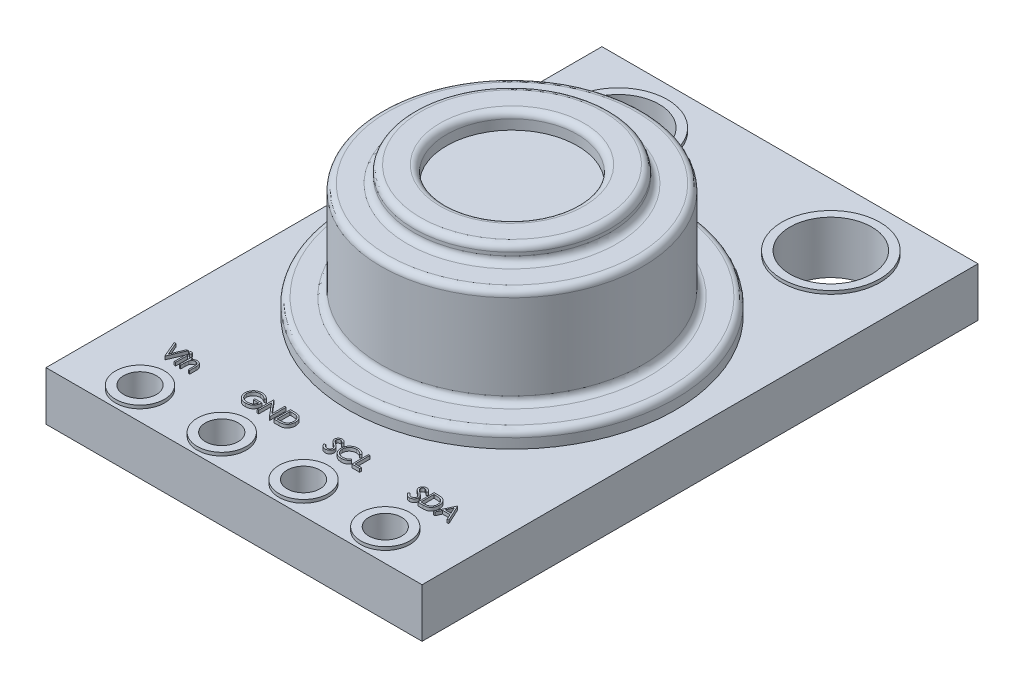
from build123d import *

# Parameters (mm, degrees)
ESBO_O1_W                = 11.5
ESBO_O1_H                = 17
RESSALTO_EXTRUS_O1_DEPTH = 1.5
ESBO_O4_R                = 5
RESSALTO_EXTRUS_O2_DEPTH = 0.5
ESBO_O5_R                = 4
RESSALTO_EXTRUS_O3_DEPTH = 3
ESBO_O6_R                = 3
RESSALTO_EXTRUS_O4_DEPTH = 0.5
ESBO_O7_R                = 2
CORTE_EXTRUS_O1_DEPTH    = 0.5
FILETE1_R                = 0.2
ESBO_O8_R                = 1.5
ESBO_O8_R_2              = 1.25
ESBO_O8_R_3              = 0.75
ESBO_O8_R_4              = 0.5
RESSALTO_EXTRUS_O5_DEPTH = 0.1
CORTE_EXTRUS_O4_START    = -3
ESBO_O9_R                = 0.5
ESBO_O9_R_2              = 1.25
CORTE_EXTRUS_O4_DEPTH    = 3
ESBO_O10_W               = 0.044871795
ESBO_O10_H               = 0.365384616
RESSALTO_EXTRUS_O6_DEPTH = 0.1


with BuildPart() as part:
    # Esboço1 → Ressalto-extrusão1 (new body)
    with BuildSketch(Plane(origin=(0, 0, 0), x_dir=(1, 0, 0), z_dir=(0, 1, 0))):
        with Locations((5.75, 8.5)):
            Rectangle(ESBO_O1_W, ESBO_O1_H)
    extrude(amount=RESSALTO_EXTRUS_O1_DEPTH)

    # Esboço4 → Ressalto-extrusão2 (add)
    with BuildSketch(Plane(origin=(0, 1.5, 0), x_dir=(1, 0, 0), z_dir=(0, 1, 0))):
        with Locations(Location((5.75, 8.5, 0), (0, 0, 270))):
            Circle(ESBO_O4_R)
    extrude(amount=RESSALTO_EXTRUS_O2_DEPTH)

    # Esboço5 → Ressalto-extrusão3 (add)
    with BuildSketch(Plane(origin=(0, 2, 0), x_dir=(1, 0, 0), z_dir=(0, 1, 0))):
        with Locations(Location((5.75, 8.5, 0), (0, 0, 270))):
            Circle(ESBO_O5_R)
    extrude(amount=RESSALTO_EXTRUS_O3_DEPTH)

    # Esboço6 → Ressalto-extrusão4 (add)
    with BuildSketch(Plane(origin=(0, 5, 0), x_dir=(1, 0, 0), z_dir=(0, 1, 0))):
        with Locations(Location((5.75, 8.5, 0), (0, 0, 270))):
            Circle(ESBO_O6_R)
    extrude(amount=RESSALTO_EXTRUS_O4_DEPTH)

    # Esboço7 → Corte-extrusão1 (cut)
    with BuildSketch(Plane(origin=(0, 5.5, 0), x_dir=(1, 0, 0), z_dir=(0, 1, 0))):
        with Locations(Location((5.75, 8.5, 0), (0, 0, 270))):
            Circle(ESBO_O7_R)
    extrude(amount=-CORTE_EXTRUS_O1_DEPTH, mode=Mode.SUBTRACT)

    # Filete1
    filete1_edges = [part.edges().sort_by_distance(p)[0] for p in [
        (5.75, 2, -13.5),
        (5.75, 2, -12.5),
        (5.75, 5, -12.5),
        (5.75, 5, -11.5),
        (5.75, 5.5, -11.5),
        (5.75, 5.5, -10.5),
    ]]
    fillet(filete1_edges, radius=FILETE1_R)

    # Esboço8 → Ressalto-extrusão5 (add)
    # profile 1 of 6: a face of its own
    with BuildSketch(Plane(origin=(0, 1.5, 0), x_dir=(1, 0, 0), z_dir=(0, 1, 0))):
        with Locations(Location((2.5, 15, 0), (0, 0, 90))):
            Circle(ESBO_O8_R)
        with Locations(Location((2.5, 15, 0), (0, 0, 270))):
            Circle(ESBO_O8_R_2, mode=Mode.SUBTRACT)
    # profile 2 of 6: a face of its own
    with BuildSketch(Plane(origin=(0, 1.5, 0), x_dir=(1, 0, 0), z_dir=(0, 1, 0))):
        with Locations(Location((9, 15, 0), (0, 0, 90))):
            Circle(ESBO_O8_R)
        with Locations(Location((9, 15, 0), (0, 0, 270))):
            Circle(ESBO_O8_R_2, mode=Mode.SUBTRACT)
    # profile 3 of 6: a face of its own
    with BuildSketch(Plane(origin=(0, 1.5, 0), x_dir=(1, 0, 0), z_dir=(0, 1, 0))):
        with Locations(Location((4.5, 0.875, 0), (0, 0, 90))):
            Circle(ESBO_O8_R_3)
        with Locations(Location((4.5, 0.875, 0), (0, 0, 270))):
            Circle(ESBO_O8_R_4, mode=Mode.SUBTRACT)
    # profile 4 of 6: a face of its own
    with BuildSketch(Plane(origin=(0, 1.5, 0), x_dir=(1, 0, 0), z_dir=(0, 1, 0))):
        with Locations(Location((2, 0.875, 0), (0, 0, 90))):
            Circle(ESBO_O8_R_3)
        with Locations(Location((2, 0.875, 0), (0, 0, 270))):
            Circle(ESBO_O8_R_4, mode=Mode.SUBTRACT)
    # profile 5 of 6: a face of its own
    with BuildSketch(Plane(origin=(0, 1.5, 0), x_dir=(1, 0, 0), z_dir=(0, 1, 0))):
        with Locations(Location((9.5, 0.875, 0), (0, 0, 90))):
            Circle(ESBO_O8_R_3)
        with Locations(Location((9.5, 0.875, 0), (0, 0, 90))):
            Circle(ESBO_O8_R_4, mode=Mode.SUBTRACT)
    # profile 6 of 6: a face of its own
    with BuildSketch(Plane(origin=(0, 1.5, 0), x_dir=(1, 0, 0), z_dir=(0, 1, 0))):
        with Locations(Location((7, 0.875, 0), (0, 0, 90))):
            Circle(ESBO_O8_R_3)
        with Locations(Location((7, 0.875, 0), (0, 0, 90))):
            Circle(ESBO_O8_R_4, mode=Mode.SUBTRACT)
    extrude(amount=RESSALTO_EXTRUS_O5_DEPTH)

    # Esboço9 → Corte-extrusão4 (cut)
    with BuildSketch(Plane(origin=(0, 1.5, 0), x_dir=(1, 0, 0), z_dir=(0, 1, 0)).offset(CORTE_EXTRUS_O4_START)):
        with Locations(Location((9.5, 0.875, 0), (0, 0, 90))):
            Circle(ESBO_O9_R)
        with Locations(Location((7, 0.875, 0), (0, 0, 90))):
            Circle(ESBO_O9_R)
        with Locations(Location((4.5, 0.875, 0), (0, 0, 90))):
            Circle(ESBO_O9_R)
        with Locations(Location((2, 0.875, 0), (0, 0, 90))):
            Circle(ESBO_O9_R)
        with Locations(Location((9, 15, 0), (0, 0, 90))):
            Circle(ESBO_O9_R_2)
        with Locations(Location((2.5, 15, 0), (0, 0, 90))):
            Circle(ESBO_O9_R_2)
    extrude(amount=CORTE_EXTRUS_O4_DEPTH, mode=Mode.SUBTRACT)

    # Esboço10 → Ressalto-extrusão6 (add)
    # profile 1 of 13: a face of its own
    with BuildSketch(Plane(origin=(0, 1.5, 0), x_dir=(1, 0, 0), z_dir=(0, 1, 0))):
        Polygon((1.397435897, 2.523635238), (1.445512821, 2.523635238), (1.612179487, 2.12960479), (1.778846154, 2.523635238), (1.826923077, 2.523635238), (1.615384615, 2.023635238), (1.608974359, 2.023635238), align=None)
    # profile 2 of 13: a face of its own
    with BuildSketch(Plane(origin=(0, 1.5, 0), x_dir=(1, 0, 0), z_dir=(0, 1, 0))):
        with BuildLine():
            add(Edge.make_bspline(
                [(1.919671474, 2.542866008), (1.922455948, 2.542736843), (1.927908482, 2.542483914), (1.935793235, 2.540317989), (1.942972808, 2.536646605), (1.949341056, 2.531720936), (1.954805611, 2.525928159), (1.958631427, 2.519176592), (1.96109034, 2.5118825), (1.961387277, 2.506794631), (1.961538462, 2.504204149)],
                knots=[0, 0, 0, 0, 1.055194115, 2.066272739, 3.074728998, 4.095836921, 5.109056067, 6.073838105, 7.019297344, 8, 8, 8, 8], degree=3))
            add(Edge.make_bspline(
                [(1.961538462, 2.504204149), (1.961383867, 2.501680913), (1.961078253, 2.496692773), (1.958633326, 2.489525134), (1.954773006, 2.48286738), (1.94934456, 2.47708585), (1.942971879, 2.472162904), (1.935793481, 2.468490798), (1.927908417, 2.466325064), (1.922455926, 2.466072109), (1.919671474, 2.465942931)],
                knots=[0, 0, 0, 0, 0.96129708, 1.900370562, 2.859976407, 3.87933698, 4.906634145, 5.921202961, 6.938410037, 8, 8, 8, 8], degree=3))
            add(Edge.make_bspline(
                [(1.919671474, 2.465942931), (1.916918864, 2.466067176), (1.911561266, 2.466309005), (1.903794575, 2.468533293), (1.896676219, 2.47216416), (1.890295552, 2.477053615), (1.884976953, 2.482902886), (1.881105763, 2.489521071), (1.878666483, 2.496693808), (1.878360107, 2.50168126), (1.878205128, 2.504204149)],
                knots=[0, 0, 0, 0, 1.054934014, 2.053291228, 3.073705704, 4.106921865, 5.123545215, 6.088680038, 7.033164197, 8, 8, 8, 8], degree=3))
            add(Edge.make_bspline(
                [(1.878205128, 2.504204149), (1.878356712, 2.50679427), (1.878654432, 2.511881432), (1.881107592, 2.519180722), (1.884944707, 2.525892365), (1.890299073, 2.531753151), (1.896675282, 2.536645356), (1.903794817, 2.540275496), (1.911561202, 2.542499973), (1.916918842, 2.542741775), (1.919671474, 2.542866008)],
                knots=[0, 0, 0, 0, 0.98631895, 1.937192651, 2.907499808, 3.917963147, 4.944918757, 5.95915025, 6.951458133, 8, 8, 8, 8], degree=3))
        make_face()
    # profile 3 of 13: a face of its own
    with BuildSketch(Plane(origin=(0, 1.5, 0), x_dir=(1, 0, 0), z_dir=(0, 1, 0))):
        with Locations((1.919871795, 2.206327546)):
            Rectangle(ESBO_O10_W, ESBO_O10_H)
    # profile 4 of 13: a face of its own
    with BuildSketch(Plane(origin=(0, 1.5, 0), x_dir=(1, 0, 0), z_dir=(0, 1, 0))):
        with BuildLine():
            Line((2.051282051, 2.389019854), (2.096153846, 2.389019854))
            Line((2.096153846, 2.389019854), (2.096153846, 2.323114405))
            add(Edge.make_bspline(
                [(2.096153846, 2.323114405), (2.100944937, 2.329091937), (2.110242216, 2.340691546), (2.125725692, 2.355937342), (2.142089106, 2.368500946), (2.159232249, 2.378515774), (2.177178394, 2.386065292), (2.195818147, 2.391517568), (2.215263105, 2.394786829), (2.228486596, 2.395214005), (2.235176282, 2.39543011)],
                knots=[0, 0, 0, 0, 1.12780773, 2.188550248, 3.19190651, 4.159438251, 5.104880172, 6.052711206, 7.014878035, 8, 8, 8, 8], degree=3))
            add(Edge.make_bspline(
                [(2.235176282, 2.39543011), (2.241937801, 2.395180797), (2.255171725, 2.39469283), (2.27444002, 2.390833302), (2.292436219, 2.384241123), (2.309096155, 2.375210827), (2.324114329, 2.363981331), (2.337303593, 2.350898791), (2.348212628, 2.335850779), (2.355526537, 2.321890328), (2.360344487, 2.309506215), (2.363377678, 2.298899536), (2.365953533, 2.287082657), (2.36818664, 2.274091287), (2.369697656, 2.259834403), (2.370889411, 2.244370447), (2.371743511, 2.227704428), (2.371777397, 2.216177767), (2.371794872, 2.210233796)],
                knots=[0, 0, 0, 0, 1.235846778, 2.418850247, 3.575807741, 4.728682307, 5.871620074, 6.994088408, 8.11269785, 9.256955736, 9.865816715, 10.540099792, 11.271859618, 12.076849838, 12.949306005, 13.892391288, 14.913166135, 16, 16, 16, 16], degree=3))
            Line((2.371794872, 2.210233796), (2.371794872, 2.023635238))
            Line((2.371794872, 2.023635238), (2.326923077, 2.023635238))
            Line((2.326923077, 2.023635238), (2.326923077, 2.195510238))
            add(Edge.make_bspline(
                [(2.326923077, 2.195510238), (2.326895476, 2.200484873), (2.326842679, 2.210000504), (2.326676159, 2.22362465), (2.326274758, 2.235979875), (2.325710713, 2.247036642), (2.324885137, 2.256784333), (2.324024761, 2.265242801), (2.322972622, 2.272401307), (2.322035063, 2.276710605), (2.321614583, 2.278643251)],
                knots=[0, 0, 0, 0, 1.430800155, 2.736877192, 3.918605307, 4.986035426, 5.920637409, 6.731861385, 7.431261377, 8, 8, 8, 8], degree=3))
            add(Edge.make_bspline(
                [(2.321614583, 2.278643251), (2.32009665, 2.284316278), (2.317175099, 2.295235098), (2.309955958, 2.31004572), (2.300839647, 2.322645461), (2.289711383, 2.332956421), (2.276678657, 2.340980827), (2.261777637, 2.346548535), (2.245152117, 2.350030859), (2.233458634, 2.350377592), (2.227363782, 2.350558315)],
                knots=[0, 0, 0, 0, 1.084156227, 2.086665306, 3.027808233, 3.945421172, 4.874247719, 5.839848303, 6.874090471, 8, 8, 8, 8], degree=3))
            add(Edge.make_bspline(
                [(2.227363782, 2.350558315), (2.223754113, 2.350490315), (2.216610671, 2.350355743), (2.206017818, 2.349005558), (2.195742936, 2.346797207), (2.185682906, 2.343815973), (2.176038936, 2.339721363), (2.16650118, 2.33507431), (2.157428785, 2.329281708), (2.1486283, 2.322825905), (2.140440756, 2.315671733), (2.132822422, 2.308122517), (2.126031276, 2.300083145), (2.119878608, 2.291683153), (2.114567428, 2.282807176), (2.109931272, 2.273540846), (2.105997601, 2.263871968), (2.104042931, 2.257161245), (2.103064904, 2.253803508)],
                knots=[0, 0, 0, 0, 1.023777757, 2.026029729, 3.023749952, 4.003683103, 4.997618607, 5.993177895, 7.010360494, 8.046726602, 9.087585522, 10.09234134, 11.086953743, 12.070360549, 13.043493632, 14.017870808, 15.008233677, 16, 16, 16, 16], degree=3))
            add(Edge.make_bspline(
                [(2.103064904, 2.253803508), (2.102502097, 2.251338479), (2.101276896, 2.245972239), (2.099953584, 2.237165894), (2.098752502, 2.226978755), (2.097747222, 2.215422709), (2.097132163, 2.202457299), (2.096461535, 2.188137893), (2.096217383, 2.172407395), (2.096175618, 2.161455724), (2.096153846, 2.155746617)],
                knots=[0, 0, 0, 0, 0.615963638, 1.340920617, 2.168419149, 3.115676021, 4.16674242, 5.331190069, 6.6087489, 8, 8, 8, 8], degree=3))
            Line((2.096153846, 2.155746617), (2.096153846, 2.023635238))
            Line((2.096153846, 2.023635238), (2.051282051, 2.023635238))
            Line((2.051282051, 2.023635238), (2.051282051, 2.389019854))
        make_face()
    # profile 5 of 13: a face of its own
    with BuildSketch(Plane(origin=(0, 1.5, 0), x_dir=(1, 0, 0), z_dir=(0, 1, 0))):
        with BuildLine():
            Line((4.301282051, 2.4382987), (4.262820513, 2.401840367))
            add(Edge.make_bspline(
                [(4.262820513, 2.401840367), (4.255860672, 2.408387633), (4.242106951, 2.421326042), (4.219684059, 2.438113327), (4.196289254, 2.452494198), (4.172044612, 2.464195089), (4.147550533, 2.473531198), (4.123132136, 2.480178075), (4.099039893, 2.484417009), (4.083016005, 2.484923919), (4.075120192, 2.4851737)],
                knots=[0, 0, 0, 0, 1.08915593, 2.152340314, 3.188132944, 4.216796309, 5.218260357, 6.173443236, 7.099959455, 8, 8, 8, 8], degree=3))
            add(Edge.make_bspline(
                [(4.075120192, 2.4851737), (4.070275235, 2.485114613), (4.060597887, 2.484996594), (4.046223323, 2.483490277), (4.031999518, 2.481323868), (4.017953321, 2.478189314), (4.004057423, 2.474216591), (3.990360153, 2.469247239), (3.976835959, 2.463453633), (3.963612234, 2.456758994), (3.950792162, 2.44940473), (3.938684042, 2.441254939), (3.9272107, 2.432570826), (3.916587782, 2.423134972), (3.906754184, 2.413032848), (3.897475845, 2.402452376), (3.889079088, 2.391104487), (3.881494636, 2.379197969), (3.874728691, 2.366941942), (3.868756026, 2.354454372), (3.863742156, 2.341776679), (3.859775091, 2.328892953), (3.85650214, 2.315902869), (3.854199625, 2.30271648), (3.852901522, 2.289319668), (3.852676982, 2.280348631), (3.852564103, 2.275838764)],
                knots=[0, 0, 0, 0, 1.02818874, 2.053710826, 3.065248034, 4.081641283, 5.106893873, 6.131558223, 7.173050175, 8.228653731, 9.27666206, 10.308777013, 11.325269123, 12.329503258, 13.32196095, 14.316845687, 15.314881793, 16.315733098, 17.311955233, 18.285320748, 19.252783886, 20.203351036, 21.145449891, 22.095197417, 23.042428769, 24, 24, 24, 24], degree=3))
            add(Edge.make_bspline(
                [(3.852564103, 2.275838764), (3.852672062, 2.271228647), (3.852887687, 2.262021003), (3.854267733, 2.248278992), (3.85682891, 2.234741078), (3.860252868, 2.221362773), (3.864535842, 2.208121166), (3.869874794, 2.195073665), (3.876198451, 2.182220752), (3.883517959, 2.169678235), (3.891544559, 2.15746066), (3.900536428, 2.145952157), (3.91008794, 2.134999474), (3.920547069, 2.124845794), (3.931578432, 2.115219523), (3.943511614, 2.106385877), (3.956111966, 2.098174702), (3.96939871, 2.090689485), (3.983227679, 2.084002552), (3.997407215, 2.078056281), (4.011982617, 2.073159233), (4.026877287, 2.069168075), (4.042073469, 2.065896604), (4.057648298, 2.063791964), (4.073487256, 2.062264702), (4.084164204, 2.062153035), (4.089543269, 2.062096777)],
                knots=[0, 0, 0, 0, 0.93586088, 1.869166235, 2.799637598, 3.729985548, 4.670839027, 5.622275134, 6.589130586, 7.576015415, 8.568469353, 9.55398029, 10.53834874, 11.515998671, 12.510579167, 13.508179873, 14.527009472, 15.561807829, 16.601455013, 17.643573243, 18.680854198, 19.719860599, 20.772568776, 21.833555941, 22.908541556, 24, 24, 24, 24], degree=3))
            add(Edge.make_bspline(
                [(4.089543269, 2.062096777), (4.09602589, 2.062232288), (4.10875557, 2.062498385), (4.127467919, 2.064569855), (4.145439786, 2.067805112), (4.162620672, 2.072543097), (4.179030532, 2.078586479), (4.194729524, 2.085871534), (4.209594047, 2.094677686), (4.223668786, 2.104616809), (4.236634098, 2.115690357), (4.248327544, 2.127639565), (4.258562614, 2.140406431), (4.267491857, 2.153915762), (4.274878807, 2.168279377), (4.280942064, 2.183426886), (4.285589677, 2.199365102), (4.287497531, 2.210378192), (4.288461538, 2.215942931)],
                knots=[0, 0, 0, 0, 1.13008108, 2.219097802, 3.278683437, 4.311054135, 5.322181354, 6.324827112, 7.324222904, 8.330512327, 9.32562643, 10.293043162, 11.24128371, 12.174520618, 13.111833804, 14.052305215, 15.015860969, 16, 16, 16, 16], degree=3))
            Line((4.288461538, 2.215942931), (4.121794872, 2.215942931))
            Line((4.121794872, 2.215942931), (4.121794872, 2.267224982))
            Line((4.121794872, 2.267224982), (4.333333333, 2.267224982))
            add(Edge.make_bspline(
                [(4.333333333, 2.267224982), (4.333089641, 2.257666769), (4.33261269, 2.238959621), (4.329267131, 2.211678153), (4.323864772, 2.185910768), (4.316484727, 2.16163033), (4.306931116, 2.138871245), (4.295306469, 2.117610407), (4.281424737, 2.097985167), (4.265780389, 2.079835309), (4.248223252, 2.063645422), (4.229227735, 2.049416002), (4.208762453, 2.037429914), (4.186846767, 2.027678391), (4.163552419, 2.02006782), (4.138825508, 2.014671881), (4.112699565, 2.011439029), (4.094794325, 2.011025975), (4.085637019, 2.010814726)],
                knots=[0, 0, 0, 0, 1.140356446, 2.231883559, 3.274166699, 4.278491846, 5.25512956, 6.21435461, 7.1637429, 8.11826594, 9.068280886, 10.0076534, 10.945064095, 11.891975133, 12.864533718, 13.863980011, 14.907571808, 16, 16, 16, 16], degree=3))
            add(Edge.make_bspline(
                [(4.085637019, 2.010814726), (4.079992714, 2.010896029), (4.068860325, 2.011056384), (4.052418764, 2.012196006), (4.036430533, 2.013950374), (4.02089796, 2.016599677), (4.005763911, 2.019844627), (3.991103971, 2.023999873), (3.976862293, 2.028809687), (3.963016867, 2.034280498), (3.94969336, 2.040619306), (3.936832429, 2.04766354), (3.924362982, 2.055376877), (3.912369959, 2.063892712), (3.90079087, 2.07314735), (3.889700378, 2.083159338), (3.879036395, 2.093898069), (3.872356329, 2.101523642), (3.868990385, 2.105366008)],
                knots=[0, 0, 0, 0, 1.107784379, 2.184907829, 3.233506516, 4.263428166, 5.276301166, 6.270063455, 7.25232949, 8.225834625, 9.190232166, 10.146266622, 11.1027726, 12.066435141, 13.031522626, 14.010570082, 14.99756817, 16, 16, 16, 16], degree=3))
            add(Edge.make_bspline(
                [(3.868990385, 2.105366008), (3.86410668, 2.111461815), (3.854420335, 2.123552246), (3.841952027, 2.142923667), (3.831323255, 2.162981075), (3.822699281, 2.183780308), (3.815965269, 2.20530191), (3.811135804, 2.22751838), (3.808306191, 2.250458327), (3.807898543, 2.265981937), (3.807692308, 2.273835559)],
                knots=[0, 0, 0, 0, 1.023165419, 2.029347347, 3.013907458, 3.994755782, 4.975994455, 5.96558838, 6.970761222, 8, 8, 8, 8], degree=3))
            add(Edge.make_bspline(
                [(3.807692308, 2.273835559), (3.807768342, 2.279716452), (3.807919443, 2.291403496), (3.80975166, 2.30875454), (3.812380434, 2.325797496), (3.816244299, 2.342518433), (3.821115194, 2.358928517), (3.827194263, 2.375035369), (3.834272106, 2.390848494), (3.842498605, 2.406259046), (3.851653528, 2.421062534), (3.861589274, 2.435199363), (3.872446931, 2.448412086), (3.884049188, 2.460868036), (3.896534472, 2.472410729), (3.909785818, 2.48314703), (3.923813439, 2.493091342), (3.938661465, 2.502087033), (3.954108277, 2.51016755), (3.970116848, 2.517251723), (3.986682293, 2.523106483), (4.003680504, 2.528074166), (4.021240147, 2.531747757), (4.039233795, 2.534411864), (4.057755239, 2.536234806), (4.070274672, 2.536381414), (4.076622596, 2.536455751)],
                knots=[0, 0, 0, 0, 1.008945113, 2.00506715, 2.99143336, 3.967273523, 4.948097931, 5.927297278, 6.919902385, 7.919676788, 8.923139349, 9.905703106, 10.883022732, 11.856032218, 12.825136022, 13.798837087, 14.781400844, 15.773989409, 16.776158564, 17.77167057, 18.775803737, 19.789618931, 20.80898985, 21.851988756, 22.910860228, 24, 24, 24, 24], degree=3))
            add(Edge.make_bspline(
                [(4.076622596, 2.536455751), (4.081799488, 2.536372967), (4.092064656, 2.536208815), (4.107339761, 2.535071008), (4.122378763, 2.533267596), (4.137203962, 2.530806627), (4.151764871, 2.527454671), (4.166102972, 2.523443487), (4.180239049, 2.518773227), (4.194128798, 2.513203392), (4.207865615, 2.506881445), (4.221525878, 2.499765242), (4.235062913, 2.491733099), (4.248500196, 2.482761165), (4.261922462, 2.473003534), (4.275117411, 2.462181131), (4.288403545, 2.450720737), (4.296946662, 2.442480425), (4.301282051, 2.4382987)],
                knots=[0, 0, 0, 0, 0.985871117, 1.954866573, 2.915460327, 3.869826059, 4.81536089, 5.759505086, 6.70452669, 7.649098992, 8.607881297, 9.583363685, 10.581137262, 11.603961102, 12.659522466, 13.73993555, 14.853081303, 16, 16, 16, 16], degree=3))
        make_face()
    # profile 6 of 13: a face of its own
    with BuildSketch(Plane(origin=(0, 1.5, 0), x_dir=(1, 0, 0), z_dir=(0, 1, 0))):
        Polygon((4.435897436, 2.023635238), (4.435897436, 2.523635238), (4.4453125, 2.523635238), (4.775641026, 2.130105591), (4.775641026, 2.523635238), (4.820512821, 2.523635238), (4.820512821, 2.023635238), (4.810296474, 2.023635238), (4.480769231, 2.416263444), (4.480769231, 2.023635238), align=None)
    # profile 7 of 13: a face of its own
    with BuildSketch(Plane(origin=(0, 1.5, 0), x_dir=(1, 0, 0), z_dir=(0, 1, 0))):
        with BuildLine():
            Line((4.948717949, 2.023635238), (4.948717949, 2.523635238))
            Line((4.948717949, 2.523635238), (5.049679487, 2.523635238))
            add(Edge.make_bspline(
                [(5.049679487, 2.523635238), (5.058460771, 2.523572014), (5.075426166, 2.523449865), (5.09994223, 2.522675381), (5.122625625, 2.521305314), (5.143401748, 2.519309668), (5.162327635, 2.516859234), (5.179350293, 2.513787748), (5.194557742, 2.510160866), (5.203910519, 2.507068659), (5.208333333, 2.505606392)],
                knots=[0, 0, 0, 0, 1.314313732, 2.53924729, 3.670748893, 4.714932338, 5.66265055, 6.526160246, 7.303039223, 8, 8, 8, 8], degree=3))
            add(Edge.make_bspline(
                [(5.208333333, 2.505606392), (5.214118296, 2.503402006), (5.225557038, 2.499043221), (5.24184377, 2.490820892), (5.257175964, 2.481504735), (5.271635842, 2.471082469), (5.284893103, 2.45925899), (5.29746566, 2.446536549), (5.308839192, 2.432452501), (5.319254663, 2.417298931), (5.328645471, 2.401254352), (5.336808208, 2.384349337), (5.34358735, 2.366669736), (5.349214954, 2.348264714), (5.353650162, 2.329093803), (5.356676152, 2.30913468), (5.358672008, 2.288466224), (5.358872587, 2.274441301), (5.358974359, 2.267325142)],
                knots=[0, 0, 0, 0, 0.984719456, 1.947108742, 2.898477687, 3.838006223, 4.779231079, 5.722358779, 6.681677486, 7.655904652, 8.64651281, 9.637519902, 10.640069247, 11.656948941, 12.698408672, 13.768548281, 14.867775369, 16, 16, 16, 16], degree=3))
            add(Edge.make_bspline(
                [(5.358974359, 2.267325142), (5.358884506, 2.261144965), (5.358707443, 2.248966281), (5.35711754, 2.231017582), (5.354806638, 2.213601357), (5.351228895, 2.196800543), (5.346885679, 2.180467941), (5.341319372, 2.16477762), (5.334942872, 2.149585647), (5.327507175, 2.135097436), (5.31934412, 2.12137124), (5.310583871, 2.108431879), (5.301235772, 2.09646399), (5.291210681, 2.085431331), (5.28063815, 2.075350534), (5.26944896, 2.066137389), (5.257614239, 2.057972167), (5.245186993, 2.050534009), (5.231804689, 2.044045387), (5.217213851, 2.038555385), (5.201352254, 2.034005869), (5.184258831, 2.030210027), (5.165904049, 2.027198983), (5.146269911, 2.025180927), (5.125386584, 2.023816223), (5.111046689, 2.023696738), (5.103665865, 2.023635238)],
                knots=[0, 0, 0, 0, 1.105936401, 2.179363191, 3.223086493, 4.248585256, 5.251745608, 6.245858792, 7.225916811, 8.198733463, 9.158002045, 10.082870192, 10.993790845, 11.873723703, 12.748670949, 13.606408763, 14.465103618, 15.319838547, 16.196477973, 17.123216899, 18.106603292, 19.147568657, 20.255746949, 21.433717677, 22.679120308, 24, 24, 24, 24], degree=3))
            Line((5.103665865, 2.023635238), (4.948717949, 2.023635238))
        make_face()
        with BuildLine():
            Line((4.993589744, 2.07491729), (5.050981571, 2.07491729))
            add(Edge.make_bspline(
                [(5.050981571, 2.07491729), (5.059228481, 2.074952732), (5.075090309, 2.075020901), (5.097898594, 2.075619073), (5.118738508, 2.076596492), (5.137613009, 2.07796436), (5.154511441, 2.079774163), (5.16946912, 2.081792006), (5.182437014, 2.084305927), (5.190284076, 2.086584636), (5.193910256, 2.087637642)],
                knots=[0, 0, 0, 0, 1.375205317, 2.645023457, 3.804390687, 4.853969522, 5.800190428, 6.637939096, 7.370582563, 8, 8, 8, 8], degree=3))
            add(Edge.make_bspline(
                [(5.193910256, 2.087637642), (5.198474308, 2.089245008), (5.207493399, 2.092421347), (5.220476411, 2.098215298), (5.232584555, 2.105078451), (5.244028844, 2.112707347), (5.254646938, 2.121371062), (5.264564669, 2.130881203), (5.273762069, 2.141286171), (5.282144113, 2.152573051), (5.289645299, 2.164671594), (5.296141189, 2.177462856), (5.301834265, 2.190806686), (5.306302636, 2.204907994), (5.309804862, 2.219640717), (5.312285532, 2.23500589), (5.313830492, 2.251000645), (5.314010699, 2.261879519), (5.314102564, 2.267425303)],
                knots=[0, 0, 0, 0, 0.998632004, 1.973411704, 2.929992603, 3.868527914, 4.809262121, 5.754881198, 6.702106254, 7.672490631, 8.653608572, 9.636854334, 10.631411391, 11.644891563, 12.686317036, 13.754757253, 14.855430412, 16, 16, 16, 16], degree=3))
            add(Edge.make_bspline(
                [(5.314102564, 2.267425303), (5.314029237, 2.273272943), (5.313885186, 2.284760683), (5.31207457, 2.301616497), (5.309428634, 2.317828018), (5.305602393, 2.333396332), (5.300726553, 2.348351811), (5.294641604, 2.362611741), (5.28768923, 2.376326722), (5.279417325, 2.389180203), (5.270357955, 2.401336361), (5.260303972, 2.412472778), (5.249415109, 2.422614821), (5.237810131, 2.431920437), (5.225161974, 2.440015248), (5.211768589, 2.447256202), (5.197433493, 2.45340133), (5.187460251, 2.456669738), (5.182391827, 2.458330751)],
                knots=[0, 0, 0, 0, 1.122418816, 2.205001699, 3.251619955, 4.274784885, 5.280384055, 6.268708349, 7.249350384, 8.229342522, 9.199999885, 10.157847722, 11.105861043, 12.055065948, 13.010012805, 13.98527497, 14.976112212, 16, 16, 16, 16], degree=3))
            add(Edge.make_bspline(
                [(5.182391827, 2.458330751), (5.178198806, 2.459490241), (5.169283293, 2.461955634), (5.154734798, 2.464644973), (5.138361205, 2.467017044), (5.12008982, 2.469025336), (5.099941468, 2.470466382), (5.077900656, 2.471547998), (5.053957855, 2.472277517), (5.03736035, 2.472327332), (5.028745994, 2.472353187)],
                knots=[0, 0, 0, 0, 0.674548936, 1.434276114, 2.292660221, 3.240891867, 4.284742987, 5.42552168, 6.663806718, 8, 8, 8, 8], degree=3))
            Line((5.028745994, 2.472353187), (4.993589744, 2.472353187))
            Line((4.993589744, 2.472353187), (4.993589744, 2.07491729))
        make_face(mode=Mode.SUBTRACT)
    # profile 8 of 13: a face of its own
    with BuildSketch(Plane(origin=(0, 1.5, 0), x_dir=(1, 0, 0), z_dir=(0, 1, 0))):
        with BuildLine():
            Line((6.371794872, 2.120089565), (6.4140625, 2.14543011))
            add(Edge.make_bspline(
                [(6.4140625, 2.14543011), (6.417993677, 2.138849484), (6.42552566, 2.126241258), (6.43809014, 2.109204395), (6.451109127, 2.094724087), (6.464679032, 2.082884571), (6.478717024, 2.073563302), (6.493314746, 2.066962983), (6.508423005, 2.062846415), (6.518704979, 2.062346403), (6.523838141, 2.062096777)],
                knots=[0, 0, 0, 0, 1.272034388, 2.437168799, 3.508375237, 4.49857839, 5.41946034, 6.295179144, 7.148887113, 8, 8, 8, 8], degree=3))
            add(Edge.make_bspline(
                [(6.523838141, 2.062096777), (6.528221978, 2.062218873), (6.536912946, 2.062460929), (6.549707552, 2.064786758), (6.562133524, 2.068359919), (6.573934758, 2.073477195), (6.584948417, 2.079668407), (6.594606516, 2.087146432), (6.602955961, 2.095518748), (6.609785834, 2.104859127), (6.61502584, 2.114904434), (6.619053278, 2.125215284), (6.621288288, 2.135953651), (6.621624967, 2.143183717), (6.621794872, 2.146832354)],
                knots=[0, 0, 0, 0, 1.095163259, 2.171163733, 3.241058638, 4.321873601, 5.38011039, 6.391990106, 7.366004449, 8.327778327, 9.272591725, 10.192022065, 11.087607919, 12, 12, 12, 12], degree=3))
            add(Edge.make_bspline(
                [(6.621794872, 2.146832354), (6.621584256, 2.150995332), (6.621156105, 2.159458059), (6.617537322, 2.171943724), (6.611844572, 2.184299806), (6.606592766, 2.191942843), (6.603866186, 2.195910879)],
                knots=[0, 0, 0, 0, 0.938893495, 1.908633276, 2.914225137, 4, 4, 4, 4], degree=3))
            add(Edge.make_bspline(
                [(6.603866186, 2.195910879), (6.601627527, 2.198774711), (6.596927742, 2.204786968), (6.588848097, 2.213736288), (6.579367224, 2.22296749), (6.568809573, 2.23283307), (6.55679056, 2.242874184), (6.54368663, 2.253569652), (6.529163221, 2.264512734), (6.518977579, 2.271851672), (6.513721955, 2.275638444)],
                knots=[0, 0, 0, 0, 0.722233717, 1.516239348, 2.393582979, 3.351407094, 4.387010283, 5.505090956, 6.712668013, 8, 8, 8, 8], degree=3))
            add(Edge.make_bspline(
                [(6.513721955, 2.275638444), (6.508461384, 2.279385385), (6.498403573, 2.286549251), (6.484338062, 2.297181291), (6.471760281, 2.306901844), (6.460726136, 2.315802417), (6.451240479, 2.323884218), (6.443228563, 2.331069638), (6.436894484, 2.337553004), (6.433372258, 2.34175891), (6.431790865, 2.343647258)],
                knots=[0, 0, 0, 0, 1.452282411, 2.77665338, 3.964542531, 5.026858415, 5.96415736, 6.766646006, 7.446254459, 8, 8, 8, 8], degree=3))
            add(Edge.make_bspline(
                [(6.431790865, 2.343647258), (6.429580502, 2.346590263), (6.425233525, 2.352378078), (6.419495524, 2.361424486), (6.414618501, 2.370684953), (6.410795311, 2.380184362), (6.407575851, 2.389789352), (6.405410432, 2.399625244), (6.404054518, 2.409647904), (6.403915663, 2.416392689), (6.403846154, 2.419769053)],
                knots=[0, 0, 0, 0, 1.068054152, 2.10047183, 3.106115577, 4.101338837, 5.06977816, 6.043150881, 7.020423561, 8, 8, 8, 8], degree=3))
            add(Edge.make_bspline(
                [(6.403846154, 2.419769053), (6.404032612, 2.42505902), (6.404401544, 2.435525887), (6.407521618, 2.450816005), (6.412446317, 2.465414065), (6.419345586, 2.479175541), (6.428239494, 2.49174211), (6.438531776, 2.503258322), (6.45079056, 2.512939548), (6.464240935, 2.521398414), (6.478963273, 2.52801926), (6.494390545, 2.533013686), (6.51054727, 2.53584358), (6.521490575, 2.536249689), (6.527043269, 2.536455751)],
                knots=[0, 0, 0, 0, 1.005424448, 1.989358655, 2.955360095, 3.929531133, 4.905563448, 5.876582895, 6.856512386, 7.866279853, 8.892233794, 9.918561126, 10.94386622, 12, 12, 12, 12], degree=3))
            add(Edge.make_bspline(
                [(6.527043269, 2.536455751), (6.532935284, 2.53625253), (6.54465262, 2.535848387), (6.561888222, 2.532334454), (6.57848261, 2.526520072), (6.591831648, 2.519921692), (6.602279185, 2.51333149), (6.610246718, 2.507328658), (6.61832064, 2.500417928), (6.626566076, 2.492580893), (6.634843313, 2.483745643), (6.643275235, 2.473972687), (6.651881559, 2.463321751), (6.657418111, 2.455718251), (6.66025641, 2.451820335)],
                knots=[0, 0, 0, 0, 1.286793592, 2.559021753, 3.825965368, 5.121522368, 5.803751409, 6.523245864, 7.299691795, 8.125521123, 9.008227632, 9.944561021, 10.946284179, 12, 12, 12, 12], degree=3))
            Line((6.66025641, 2.451820335), (6.619691506, 2.421071136))
            add(Edge.make_bspline(
                [(6.619691506, 2.421071136), (6.617242087, 2.424226663), (6.612525079, 2.430303471), (6.605363724, 2.438813659), (6.598613917, 2.446587441), (6.59196386, 2.453339603), (6.58576477, 2.459439907), (6.57974805, 2.46466273), (6.574000285, 2.469059243), (6.566755012, 2.473751181), (6.557652481, 2.47840211), (6.546226119, 2.482337692), (6.534285222, 2.484702701), (6.526152418, 2.485015399), (6.522035256, 2.4851737)],
                knots=[0, 0, 0, 0, 1.181633172, 2.275549214, 3.290209073, 4.226197932, 5.078386478, 5.862611352, 6.581680152, 7.217281963, 8.414376989, 9.595101626, 10.782541182, 12, 12, 12, 12], degree=3))
            add(Edge.make_bspline(
                [(6.522035256, 2.4851737), (6.516870039, 2.4850006), (6.506909404, 2.484666793), (6.492767941, 2.481021081), (6.480040238, 2.475280815), (6.469104157, 2.467235818), (6.459998875, 2.457704248), (6.45341238, 2.44673584), (6.449448071, 2.434624068), (6.448964317, 2.42617526), (6.448717949, 2.421872418)],
                knots=[0, 0, 0, 0, 1.14458467, 2.207223713, 3.21896685, 4.227309161, 5.202851033, 6.127160689, 7.046193047, 8, 8, 8, 8], degree=3))
            add(Edge.make_bspline(
                [(6.448717949, 2.421872418), (6.44877411, 2.419193635), (6.448886523, 2.41383169), (6.450454352, 2.405910058), (6.452468541, 2.398008438), (6.455660346, 2.390162355), (6.460066818, 2.382234589), (6.465853272, 2.374088627), (6.473140888, 2.365652668), (6.478723318, 2.360165901), (6.481670673, 2.357269053)],
                knots=[0, 0, 0, 0, 0.858281714, 1.717966888, 2.583508476, 3.4729293, 4.427298488, 5.488583878, 6.674047936, 8, 8, 8, 8], degree=3))
            add(Edge.make_bspline(
                [(6.481670673, 2.357269053), (6.482765155, 2.356292335), (6.485365393, 2.353971876), (6.490119097, 2.350172979), (6.496396639, 2.345486869), (6.504034097, 2.339688681), (6.513172291, 2.332962757), (6.523812228, 2.325395099), (6.535835304, 2.316740033), (6.544367006, 2.310688956), (6.548878205, 2.307489405)],
                knots=[0, 0, 0, 0, 0.420754252, 0.999615792, 1.744751191, 2.668019286, 3.750313428, 4.999500688, 6.413464383, 8, 8, 8, 8], degree=3))
            add(Edge.make_bspline(
                [(6.548878205, 2.307489405), (6.554304764, 2.303540639), (6.564812544, 2.295894402), (6.579763626, 2.284406448), (6.593319885, 2.273171052), (6.605528914, 2.262259966), (6.616511329, 2.251755952), (6.626145289, 2.241532641), (6.634528958, 2.231663273), (6.643554561, 2.219010048), (6.652777106, 2.203469893), (6.660697322, 2.184430145), (6.665691371, 2.165316385), (6.666344445, 2.152469694), (6.666666667, 2.146131232)],
                knots=[0, 0, 0, 0, 1.163667725, 2.253281268, 3.268753668, 4.215851969, 5.092017293, 5.902905408, 6.650798638, 7.335211899, 8.59617414, 9.77448103, 10.901945474, 12, 12, 12, 12], degree=3))
            add(Edge.make_bspline(
                [(6.666666667, 2.146131232), (6.66657279, 2.141648608), (6.666386859, 2.132770411), (6.664249586, 2.119733971), (6.661118205, 2.107072418), (6.6563986, 2.09494226), (6.650638149, 2.083121579), (6.643328685, 2.07192045), (6.634856159, 2.061090965), (6.625137049, 2.050921895), (6.61450192, 2.041586724), (6.603261393, 2.033282572), (6.591397068, 2.026358526), (6.578973308, 2.020708406), (6.56598726, 2.016289332), (6.552443291, 2.013087493), (6.538319075, 2.011122392), (6.528719006, 2.010918426), (6.523838141, 2.010814726)],
                knots=[0, 0, 0, 0, 0.983748083, 1.948392443, 2.894712957, 3.844097841, 4.80183111, 5.778335162, 6.776009319, 7.81870978, 8.863265674, 9.881300176, 10.883814829, 11.87499822, 12.874611388, 13.892143829, 14.928324115, 16, 16, 16, 16], degree=3))
            add(Edge.make_bspline(
                [(6.523838141, 2.010814726), (6.520061663, 2.010887752), (6.512556269, 2.011032884), (6.501454915, 2.012315924), (6.49057783, 2.014131224), (6.480061504, 2.017013234), (6.469770446, 2.020509945), (6.459749412, 2.024815421), (6.449993547, 2.029975022), (6.440448178, 2.035874311), (6.431137582, 2.042739703), (6.422149087, 2.050735917), (6.413187774, 2.059642417), (6.404518146, 2.069701069), (6.39596484, 2.080749367), (6.387696496, 2.092890679), (6.379541965, 2.106058872), (6.374425469, 2.115325313), (6.371794872, 2.120089565)],
                knots=[0, 0, 0, 0, 0.915332311, 1.819136955, 2.706846663, 3.586547465, 4.459518054, 5.340707479, 6.227863349, 7.133153174, 8.059268498, 9.028702269, 10.047606654, 11.120612155, 12.245963614, 13.433783089, 14.680604001, 16, 16, 16, 16], degree=3))
        make_face()
    # profile 9 of 13: a face of its own
    with BuildSketch(Plane(origin=(0, 1.5, 0), x_dir=(1, 0, 0), z_dir=(0, 1, 0))):
        with BuildLine():
            Line((7.230769231, 2.431888444), (7.19150641, 2.401840367))
            add(Edge.make_bspline(
                [(7.19150641, 2.401840367), (7.188705569, 2.405178362), (7.183141648, 2.41180935), (7.174190333, 2.421120714), (7.164861527, 2.429844323), (7.155158796, 2.438021734), (7.144907493, 2.445366986), (7.13435595, 2.452262858), (7.123327658, 2.458443963), (7.10807741, 2.465938676), (7.088127718, 2.473759555), (7.063014169, 2.48031716), (7.036798298, 2.484491613), (7.018912927, 2.484943733), (7.009815705, 2.4851737)],
                knots=[0, 0, 0, 0, 0.757959112, 1.505699292, 2.245454638, 2.979532153, 3.711538275, 4.438200793, 5.171680507, 5.909471876, 7.393775596, 8.890124382, 10.418191784, 12, 12, 12, 12], degree=3))
            add(Edge.make_bspline(
                [(7.009815705, 2.4851737), (7.004803805, 2.485115991), (6.994826521, 2.485001109), (6.980019596, 2.483485519), (6.96548916, 2.481355347), (6.951244665, 2.478194586), (6.937304242, 2.474198498), (6.923576756, 2.469423439), (6.910260956, 2.463515604), (6.897172636, 2.456985853), (6.884632749, 2.449610504), (6.872767742, 2.441565739), (6.86162089, 2.432941582), (6.851183374, 2.42370571), (6.841444524, 2.413899716), (6.832474908, 2.403419096), (6.824305564, 2.392297356), (6.81677456, 2.380681155), (6.810029884, 2.368604328), (6.804382758, 2.356022175), (6.799382027, 2.34315016), (6.795424992, 2.329842852), (6.792292918, 2.316193885), (6.790131823, 2.30216663), (6.78863347, 2.28779039), (6.788519159, 2.278046202), (6.788461538, 2.273134437)],
                knots=[0, 0, 0, 0, 1.054917814, 2.100044995, 3.131103042, 4.146048494, 5.169673617, 6.183595914, 7.203665975, 8.234915748, 9.262203917, 10.264457458, 11.251630812, 12.227803204, 13.197192746, 14.159520551, 15.12972552, 16.100847026, 17.073214652, 18.039054194, 19.002613845, 19.979014051, 20.95965708, 21.949030935, 22.966165397, 24, 24, 24, 24], degree=3))
            add(Edge.make_bspline(
                [(6.788461538, 2.273134437), (6.788641798, 2.265744249), (6.788995715, 2.251234594), (6.792145477, 2.229981649), (6.796931918, 2.209621553), (6.804105572, 2.190281576), (6.812951151, 2.171723239), (6.824128381, 2.154260545), (6.837073601, 2.137629608), (6.851969946, 2.122223472), (6.868313634, 2.108150083), (6.88584905, 2.095757143), (6.90453252, 2.085426445), (6.924157753, 2.076829881), (6.944875769, 2.070221777), (6.966649312, 2.06556976), (6.989431026, 2.062535162), (7.004998083, 2.062244636), (7.012920673, 2.062096777)],
                knots=[0, 0, 0, 0, 1.029171465, 2.020641659, 2.987623507, 3.938342917, 4.889210282, 5.84687017, 6.821220943, 7.821438502, 8.827599549, 9.822697543, 10.807740252, 11.797342354, 12.80366471, 13.83203677, 14.896651826, 16, 16, 16, 16], degree=3))
            add(Edge.make_bspline(
                [(7.012920673, 2.062096777), (7.021649629, 2.062338031), (7.038830301, 2.062812877), (7.064025734, 2.066835627), (7.088145129, 2.073358187), (7.111189784, 2.082486461), (7.133094733, 2.094352931), (7.153894256, 2.108738342), (7.173605909, 2.125779533), (7.18545895, 2.138791408), (7.19150641, 2.14543011)],
                knots=[0, 0, 0, 0, 1.028121516, 2.023589091, 2.998037872, 3.967518031, 4.937445131, 5.927275754, 6.942489185, 8, 8, 8, 8], degree=3))
            Line((7.19150641, 2.14543011), (7.230769231, 2.115682514))
            add(Edge.make_bspline(
                [(7.230769231, 2.115682514), (7.227609501, 2.111605592), (7.221305176, 2.103471277), (7.211096888, 2.09200389), (7.200342988, 2.081217599), (7.188963601, 2.071199368), (7.177089631, 2.06174873), (7.164507872, 2.053134182), (7.151383724, 2.045235485), (7.137761656, 2.038003067), (7.12365614, 2.031586317), (7.109084078, 2.026092922), (7.094108281, 2.021360795), (7.078728066, 2.017467661), (7.062911529, 2.014428935), (7.046715747, 2.012397553), (7.030105765, 2.011005851), (7.018899847, 2.010879005), (7.013221154, 2.010814726)],
                knots=[0, 0, 0, 0, 0.986787822, 1.968848986, 2.935600012, 3.899624008, 4.868462664, 5.837806735, 6.815139263, 7.798259679, 8.787526145, 9.778297419, 10.776456485, 11.791383307, 12.812564526, 13.85620153, 14.913611965, 16, 16, 16, 16], degree=3))
            add(Edge.make_bspline(
                [(7.013221154, 2.010814726), (7.007843487, 2.010852153), (6.997209817, 2.010926161), (6.981509995, 2.012125042), (6.96622577, 2.013760719), (6.951400823, 2.016223595), (6.936954255, 2.019129929), (6.923017029, 2.023025823), (6.909451999, 2.02738999), (6.896313664, 2.032519274), (6.88359085, 2.0383073), (6.871324591, 2.044848951), (6.85952053, 2.052089217), (6.848062612, 2.059868505), (6.8371201, 2.068436691), (6.826598168, 2.077674781), (6.816437814, 2.08755164), (6.810151717, 2.094673762), (6.806991186, 2.098254629)],
                knots=[0, 0, 0, 0, 1.114604814, 2.203992996, 3.262667896, 4.300477797, 5.318619304, 6.316056647, 7.298880507, 8.271930387, 9.238335007, 10.195173496, 11.151986948, 12.108099108, 13.064862484, 14.031167946, 15.010108607, 16, 16, 16, 16], degree=3))
            add(Edge.make_bspline(
                [(6.806991186, 2.098254629), (6.801928951, 2.104474799), (6.791865597, 2.116840044), (6.7789905, 2.136880898), (6.76796942, 2.157804928), (6.759058574, 2.179722061), (6.75209247, 2.202583116), (6.747266585, 2.226399618), (6.744130641, 2.251149324), (6.743772029, 2.267983151), (6.743589744, 2.276539886)],
                knots=[0, 0, 0, 0, 0.994628077, 1.977248131, 2.950237994, 3.925870899, 4.908910175, 5.911660606, 6.938484602, 8, 8, 8, 8], degree=3))
            add(Edge.make_bspline(
                [(6.743589744, 2.276539886), (6.743811914, 2.285533522), (6.744249021, 2.30322794), (6.747962706, 2.329195648), (6.75393682, 2.354074419), (6.762422089, 2.377817811), (6.773179997, 2.400550708), (6.786469513, 2.422099452), (6.802136248, 2.442601852), (6.820057329, 2.461746816), (6.839709805, 2.479252438), (6.86075535, 2.494653324), (6.883152771, 2.507470112), (6.906655321, 2.51818385), (6.93143899, 2.526418773), (6.9574509, 2.532183514), (6.984642173, 2.535771673), (7.003193948, 2.536225274), (7.012620192, 2.536455751)],
                knots=[0, 0, 0, 0, 1.032925535, 2.032216505, 3.007276963, 3.968222605, 4.92396291, 5.891752235, 6.871517503, 7.883894988, 8.900124299, 9.891468569, 10.874487609, 11.85992873, 12.854644235, 13.869047385, 14.917252991, 16, 16, 16, 16], degree=3))
            add(Edge.make_bspline(
                [(7.012620192, 2.536455751), (7.018365117, 2.536386874), (7.029736616, 2.53625054), (7.046558424, 2.534921091), (7.062935899, 2.532704861), (7.078880325, 2.52968828), (7.09446927, 2.525944377), (7.109583591, 2.521067191), (7.124311974, 2.515490544), (7.138561533, 2.509067906), (7.152263897, 2.501858371), (7.1654148, 2.493941854), (7.177909779, 2.485328167), (7.189836758, 2.476090571), (7.200996217, 2.466033634), (7.211704999, 2.455433977), (7.221599439, 2.443986288), (7.227707038, 2.43592844), (7.230769231, 2.431888444)],
                knots=[0, 0, 0, 0, 1.096760587, 2.17092713, 3.219439832, 4.250915756, 5.268269357, 6.278326846, 7.281116186, 8.274029601, 9.260640565, 10.235837813, 11.203064059, 12.156899882, 13.114053108, 14.069676657, 15.032185724, 16, 16, 16, 16], degree=3))
        make_face()
    # profile 10 of 13: a face of its own
    with BuildSketch(Plane(origin=(0, 1.5, 0), x_dir=(1, 0, 0), z_dir=(0, 1, 0))):
        Polygon((7.333333333, 2.523635238), (7.378205128, 2.523635238), (7.378205128, 2.07491729), (7.570512821, 2.07491729), (7.570512821, 2.023635238), (7.333333333, 2.023635238), align=None)
    # profile 11 of 13: a face of its own
    with BuildSketch(Plane(origin=(0, 1.5, 0), x_dir=(1, 0, 0), z_dir=(0, 1, 0))):
        with BuildLine():
            Line((8.948717949, 2.120089565), (8.990985577, 2.14543011))
            add(Edge.make_bspline(
                [(8.990985577, 2.14543011), (8.994916754, 2.138849484), (9.002448737, 2.126241258), (9.015013216, 2.109204395), (9.028032204, 2.094724087), (9.041602109, 2.082884571), (9.055640101, 2.073563302), (9.070237823, 2.066962983), (9.085346082, 2.062846415), (9.095628056, 2.062346403), (9.100761218, 2.062096777)],
                knots=[0, 0, 0, 0, 1.272034388, 2.437168799, 3.508375237, 4.49857839, 5.41946034, 6.295179144, 7.148887113, 8, 8, 8, 8], degree=3))
            add(Edge.make_bspline(
                [(9.100761218, 2.062096777), (9.105145055, 2.062218873), (9.113836023, 2.062460929), (9.126630629, 2.064786758), (9.139056601, 2.068359919), (9.150857835, 2.073477195), (9.161871494, 2.079668407), (9.171529593, 2.087146432), (9.179879038, 2.095518748), (9.186708911, 2.104859127), (9.191948916, 2.114904434), (9.195976355, 2.125215284), (9.198211365, 2.135953651), (9.198548044, 2.143183717), (9.198717949, 2.146832354)],
                knots=[0, 0, 0, 0, 1.095163259, 2.171163733, 3.241058638, 4.321873601, 5.38011039, 6.391990106, 7.366004449, 8.327778327, 9.272591725, 10.192022065, 11.087607919, 12, 12, 12, 12], degree=3))
            add(Edge.make_bspline(
                [(9.198717949, 2.146832354), (9.198507333, 2.150995332), (9.198079182, 2.159458059), (9.194460399, 2.171943724), (9.188767649, 2.184299806), (9.183515843, 2.191942843), (9.180789263, 2.195910879)],
                knots=[0, 0, 0, 0, 0.938893495, 1.908633276, 2.914225137, 4, 4, 4, 4], degree=3))
            add(Edge.make_bspline(
                [(9.180789263, 2.195910879), (9.178550604, 2.198774711), (9.173850819, 2.204786968), (9.165771174, 2.213736288), (9.156290301, 2.22296749), (9.14573265, 2.23283307), (9.133713637, 2.242874184), (9.120609707, 2.253569652), (9.106086298, 2.264512734), (9.095900656, 2.271851672), (9.090645032, 2.275638444)],
                knots=[0, 0, 0, 0, 0.722233717, 1.516239348, 2.393582979, 3.351407094, 4.387010283, 5.505090956, 6.712668013, 8, 8, 8, 8], degree=3))
            add(Edge.make_bspline(
                [(9.090645032, 2.275638444), (9.085384461, 2.279385385), (9.07532665, 2.286549251), (9.061261138, 2.297181291), (9.048683358, 2.306901844), (9.037649213, 2.315802417), (9.028163556, 2.323884218), (9.02015164, 2.331069638), (9.013817561, 2.337553004), (9.010295335, 2.34175891), (9.008713942, 2.343647258)],
                knots=[0, 0, 0, 0, 1.452282411, 2.77665338, 3.964542531, 5.026858415, 5.96415736, 6.766646006, 7.446254459, 8, 8, 8, 8], degree=3))
            add(Edge.make_bspline(
                [(9.008713942, 2.343647258), (9.006503579, 2.346590263), (9.002156602, 2.352378078), (8.996418601, 2.361424486), (8.991541578, 2.370684953), (8.987718388, 2.380184362), (8.984498928, 2.389789352), (8.982333509, 2.399625244), (8.980977595, 2.409647904), (8.98083874, 2.416392689), (8.980769231, 2.419769053)],
                knots=[0, 0, 0, 0, 1.068054152, 2.10047183, 3.106115577, 4.101338837, 5.06977816, 6.043150881, 7.020423561, 8, 8, 8, 8], degree=3))
            add(Edge.make_bspline(
                [(8.980769231, 2.419769053), (8.980955689, 2.42505902), (8.981324621, 2.435525887), (8.984444695, 2.450816005), (8.989369394, 2.465414065), (8.996268663, 2.479175541), (9.005162571, 2.49174211), (9.015454853, 2.503258322), (9.027713637, 2.512939548), (9.041164011, 2.521398414), (9.05588635, 2.52801926), (9.071313622, 2.533013686), (9.087470347, 2.53584358), (9.098413652, 2.536249689), (9.103966346, 2.536455751)],
                knots=[0, 0, 0, 0, 1.005424448, 1.989358655, 2.955360095, 3.929531133, 4.905563448, 5.876582895, 6.856512386, 7.866279853, 8.892233794, 9.918561126, 10.94386622, 12, 12, 12, 12], degree=3))
            add(Edge.make_bspline(
                [(9.103966346, 2.536455751), (9.10985836, 2.53625253), (9.121575696, 2.535848387), (9.138811299, 2.532334454), (9.155405687, 2.526520072), (9.168754725, 2.519921692), (9.179202262, 2.51333149), (9.187169795, 2.507328658), (9.195243717, 2.500417928), (9.203489153, 2.492580893), (9.21176639, 2.483745643), (9.220198312, 2.473972687), (9.228804636, 2.463321751), (9.234341187, 2.455718251), (9.237179487, 2.451820335)],
                knots=[0, 0, 0, 0, 1.286793592, 2.559021753, 3.825965368, 5.121522368, 5.803751409, 6.523245864, 7.299691795, 8.125521123, 9.008227632, 9.944561021, 10.946284179, 12, 12, 12, 12], degree=3))
            Line((9.237179487, 2.451820335), (9.196614583, 2.421071136))
            add(Edge.make_bspline(
                [(9.196614583, 2.421071136), (9.194165164, 2.424226663), (9.189448156, 2.430303471), (9.182286801, 2.438813659), (9.175536994, 2.446587441), (9.168886937, 2.453339603), (9.162687847, 2.459439907), (9.156671127, 2.46466273), (9.150923362, 2.469059243), (9.143678089, 2.473751181), (9.134575558, 2.47840211), (9.123149196, 2.482337692), (9.111208299, 2.484702701), (9.103075495, 2.485015399), (9.098958333, 2.4851737)],
                knots=[0, 0, 0, 0, 1.181633172, 2.275549214, 3.290209073, 4.226197932, 5.078386478, 5.862611352, 6.581680152, 7.217281963, 8.414376989, 9.595101626, 10.782541182, 12, 12, 12, 12], degree=3))
            add(Edge.make_bspline(
                [(9.098958333, 2.4851737), (9.093793116, 2.4850006), (9.083832481, 2.484666793), (9.069691018, 2.481021081), (9.056963315, 2.475280815), (9.046027234, 2.467235818), (9.036921951, 2.457704248), (9.030335457, 2.44673584), (9.026371148, 2.434624068), (9.025887394, 2.42617526), (9.025641026, 2.421872418)],
                knots=[0, 0, 0, 0, 1.14458467, 2.207223713, 3.21896685, 4.227309161, 5.202851033, 6.127160689, 7.046193047, 8, 8, 8, 8], degree=3))
            add(Edge.make_bspline(
                [(9.025641026, 2.421872418), (9.025697187, 2.419193635), (9.0258096, 2.41383169), (9.027377429, 2.405910058), (9.029391618, 2.398008438), (9.032583423, 2.390162355), (9.036989895, 2.382234589), (9.042776349, 2.374088627), (9.050063965, 2.365652668), (9.055646395, 2.360165901), (9.05859375, 2.357269053)],
                knots=[0, 0, 0, 0, 0.858281714, 1.717966888, 2.583508476, 3.4729293, 4.427298488, 5.488583878, 6.674047936, 8, 8, 8, 8], degree=3))
            add(Edge.make_bspline(
                [(9.05859375, 2.357269053), (9.059688232, 2.356292335), (9.06228847, 2.353971876), (9.067042174, 2.350172979), (9.073319716, 2.345486869), (9.080957174, 2.339688681), (9.090095368, 2.332962757), (9.100735305, 2.325395099), (9.112758381, 2.316740033), (9.121290083, 2.310688956), (9.125801282, 2.307489405)],
                knots=[0, 0, 0, 0, 0.420754252, 0.999615792, 1.744751191, 2.668019286, 3.750313428, 4.999500688, 6.413464383, 8, 8, 8, 8], degree=3))
            add(Edge.make_bspline(
                [(9.125801282, 2.307489405), (9.131227841, 2.303540639), (9.141735621, 2.295894402), (9.156686703, 2.284406448), (9.170242962, 2.273171052), (9.182451991, 2.262259966), (9.193434406, 2.251755952), (9.203068366, 2.241532641), (9.211452035, 2.231663273), (9.220477638, 2.219010048), (9.229700183, 2.203469893), (9.237620399, 2.184430145), (9.242614448, 2.165316385), (9.243267522, 2.152469694), (9.243589744, 2.146131232)],
                knots=[0, 0, 0, 0, 1.163667725, 2.253281268, 3.268753668, 4.215851969, 5.092017293, 5.902905408, 6.650798638, 7.335211899, 8.59617414, 9.77448103, 10.901945474, 12, 12, 12, 12], degree=3))
            add(Edge.make_bspline(
                [(9.243589744, 2.146131232), (9.243495867, 2.141648608), (9.243309936, 2.132770411), (9.241172663, 2.119733971), (9.238041282, 2.107072418), (9.233321677, 2.09494226), (9.227561226, 2.083121579), (9.220251762, 2.07192045), (9.211779235, 2.061090965), (9.202060126, 2.050921895), (9.191424997, 2.041586724), (9.180184469, 2.033282572), (9.168320145, 2.026358526), (9.155896385, 2.020708406), (9.142910337, 2.016289332), (9.129366368, 2.013087493), (9.115242152, 2.011122392), (9.105642083, 2.010918426), (9.100761218, 2.010814726)],
                knots=[0, 0, 0, 0, 0.983748083, 1.948392443, 2.894712957, 3.844097841, 4.80183111, 5.778335162, 6.776009319, 7.81870978, 8.863265674, 9.881300176, 10.883814829, 11.87499822, 12.874611388, 13.892143829, 14.928324115, 16, 16, 16, 16], degree=3))
            add(Edge.make_bspline(
                [(9.100761218, 2.010814726), (9.09698474, 2.010887752), (9.089479346, 2.011032884), (9.078377992, 2.012315924), (9.067500907, 2.014131224), (9.056984581, 2.017013234), (9.046693523, 2.020509945), (9.036672489, 2.024815421), (9.026916624, 2.029975022), (9.017371255, 2.035874311), (9.008060659, 2.042739703), (8.999072163, 2.050735917), (8.990110851, 2.059642417), (8.981441223, 2.069701069), (8.972887917, 2.080749367), (8.964619573, 2.092890679), (8.956465042, 2.106058872), (8.951348546, 2.115325313), (8.948717949, 2.120089565)],
                knots=[0, 0, 0, 0, 0.915332311, 1.819136955, 2.706846663, 3.586547465, 4.459518054, 5.340707479, 6.227863349, 7.133153174, 8.059268498, 9.028702269, 10.047606654, 11.120612155, 12.245963614, 13.433783089, 14.680604001, 16, 16, 16, 16], degree=3))
        make_face()
    # profile 12 of 13: a face of its own
    with BuildSketch(Plane(origin=(0, 1.5, 0), x_dir=(1, 0, 0), z_dir=(0, 1, 0))):
        with BuildLine():
            Line((9.346153846, 2.023635238), (9.346153846, 2.523635238))
            Line((9.346153846, 2.523635238), (9.447115385, 2.523635238))
            add(Edge.make_bspline(
                [(9.447115385, 2.523635238), (9.455896669, 2.523572014), (9.472862064, 2.523449865), (9.497378128, 2.522675381), (9.520061522, 2.521305314), (9.540837645, 2.519309668), (9.559763532, 2.516859234), (9.576786191, 2.513787748), (9.59199364, 2.510160866), (9.601346417, 2.507068659), (9.605769231, 2.505606392)],
                knots=[0, 0, 0, 0, 1.314313732, 2.53924729, 3.670748893, 4.714932338, 5.66265055, 6.526160246, 7.303039223, 8, 8, 8, 8], degree=3))
            add(Edge.make_bspline(
                [(9.605769231, 2.505606392), (9.611554194, 2.503402006), (9.622992935, 2.499043221), (9.639279667, 2.490820892), (9.654611862, 2.481504735), (9.66907174, 2.471082469), (9.682329001, 2.45925899), (9.694901557, 2.446536549), (9.706275089, 2.432452501), (9.71669056, 2.417298931), (9.726081369, 2.401254352), (9.734244105, 2.384349337), (9.741023247, 2.366669736), (9.746650851, 2.348264714), (9.751086059, 2.329093803), (9.75411205, 2.30913468), (9.756107905, 2.288466224), (9.756308484, 2.274441301), (9.756410256, 2.267325142)],
                knots=[0, 0, 0, 0, 0.984719456, 1.947108742, 2.898477687, 3.838006223, 4.779231079, 5.722358779, 6.681677486, 7.655904652, 8.64651281, 9.637519902, 10.640069247, 11.656948941, 12.698408672, 13.768548281, 14.867775369, 16, 16, 16, 16], degree=3))
            add(Edge.make_bspline(
                [(9.756410256, 2.267325142), (9.756320404, 2.261144965), (9.75614334, 2.248966281), (9.754553438, 2.231017582), (9.752242535, 2.213601357), (9.748664793, 2.196800543), (9.744321576, 2.180467941), (9.738755269, 2.16477762), (9.73237877, 2.149585647), (9.724943073, 2.135097436), (9.716780018, 2.12137124), (9.708019769, 2.108431879), (9.698671669, 2.09646399), (9.688646579, 2.085431331), (9.678074048, 2.075350534), (9.666884858, 2.066137389), (9.655050136, 2.057972167), (9.64262289, 2.050534009), (9.629240586, 2.044045387), (9.614649748, 2.038555385), (9.598788151, 2.034005869), (9.581694729, 2.030210027), (9.563339946, 2.027198983), (9.543705808, 2.025180927), (9.522822481, 2.023816223), (9.508482586, 2.023696738), (9.501101763, 2.023635238)],
                knots=[0, 0, 0, 0, 1.105936401, 2.179363191, 3.223086493, 4.248585256, 5.251745608, 6.245858792, 7.225916811, 8.198733463, 9.158002045, 10.082870192, 10.993790845, 11.873723703, 12.748670949, 13.606408763, 14.465103618, 15.319838547, 16.196477973, 17.123216899, 18.106603292, 19.147568657, 20.255746949, 21.433717677, 22.679120308, 24, 24, 24, 24], degree=3))
            Line((9.501101763, 2.023635238), (9.346153846, 2.023635238))
        make_face()
        with BuildLine():
            Line((9.391025641, 2.07491729), (9.448417468, 2.07491729))
            add(Edge.make_bspline(
                [(9.448417468, 2.07491729), (9.456664378, 2.074952732), (9.472526206, 2.075020901), (9.495334492, 2.075619073), (9.516174406, 2.076596492), (9.535048907, 2.07796436), (9.551947339, 2.079774163), (9.566905017, 2.081792006), (9.579872911, 2.084305927), (9.587719974, 2.086584636), (9.591346154, 2.087637642)],
                knots=[0, 0, 0, 0, 1.375205317, 2.645023457, 3.804390687, 4.853969522, 5.800190428, 6.637939096, 7.370582563, 8, 8, 8, 8], degree=3))
            add(Edge.make_bspline(
                [(9.591346154, 2.087637642), (9.595910206, 2.089245008), (9.604929297, 2.092421347), (9.617912309, 2.098215298), (9.630020452, 2.105078451), (9.641464742, 2.112707347), (9.652082835, 2.121371062), (9.662000566, 2.130881203), (9.671197966, 2.141286171), (9.67958001, 2.152573051), (9.687081197, 2.164671594), (9.693577087, 2.177462856), (9.699270163, 2.190806686), (9.703738533, 2.204907994), (9.707240759, 2.219640717), (9.709721429, 2.23500589), (9.71126639, 2.251000645), (9.711446597, 2.261879519), (9.711538462, 2.267425303)],
                knots=[0, 0, 0, 0, 0.998632004, 1.973411704, 2.929992603, 3.868527914, 4.809262121, 5.754881198, 6.702106254, 7.672490631, 8.653608572, 9.636854334, 10.631411391, 11.644891563, 12.686317036, 13.754757253, 14.855430412, 16, 16, 16, 16], degree=3))
            add(Edge.make_bspline(
                [(9.711538462, 2.267425303), (9.711465135, 2.273272943), (9.711321084, 2.284760683), (9.709510468, 2.301616497), (9.706864531, 2.317828018), (9.703038291, 2.333396332), (9.698162451, 2.348351811), (9.692077502, 2.362611741), (9.685125128, 2.376326722), (9.676853222, 2.389180203), (9.667793852, 2.401336361), (9.657739869, 2.412472778), (9.646851007, 2.422614821), (9.635246028, 2.431920437), (9.622597871, 2.440015248), (9.609204487, 2.447256202), (9.594869391, 2.45340133), (9.584896148, 2.456669738), (9.579827724, 2.458330751)],
                knots=[0, 0, 0, 0, 1.122418816, 2.205001699, 3.251619955, 4.274784885, 5.280384055, 6.268708349, 7.249350384, 8.229342522, 9.199999885, 10.157847722, 11.105861043, 12.055065948, 13.010012805, 13.98527497, 14.976112212, 16, 16, 16, 16], degree=3))
            add(Edge.make_bspline(
                [(9.579827724, 2.458330751), (9.575634703, 2.459490241), (9.566719191, 2.461955634), (9.552170696, 2.464644973), (9.535797103, 2.467017044), (9.517525717, 2.469025336), (9.497377366, 2.470466382), (9.475336553, 2.471547998), (9.451393753, 2.472277517), (9.434796248, 2.472327332), (9.426181891, 2.472353187)],
                knots=[0, 0, 0, 0, 0.674548936, 1.434276114, 2.292660221, 3.240891867, 4.284742987, 5.42552168, 6.663806718, 8, 8, 8, 8], degree=3))
            Line((9.426181891, 2.472353187), (9.391025641, 2.472353187))
            Line((9.391025641, 2.472353187), (9.391025641, 2.07491729))
        make_face(mode=Mode.SUBTRACT)
    # profile 13 of 13: a face of its own
    with BuildSketch(Plane(origin=(0, 1.5, 0), x_dir=(1, 0, 0), z_dir=(0, 1, 0))):
        Polygon((10.064102564, 2.523635238), (10.294871795, 2.023635238), (10.24609375, 2.023635238), (10.172175481, 2.183891649), (9.945512821, 2.183891649), (9.869491186, 2.023635238), (9.820512821, 2.023635238), (10.057692308, 2.523635238), align=None)
        Polygon((10.060396635, 2.426179309), (9.969851763, 2.2351737), (10.14853766, 2.2351737), align=None, mode=Mode.SUBTRACT)
    extrude(amount=RESSALTO_EXTRUS_O6_DEPTH)


solid = part.part
